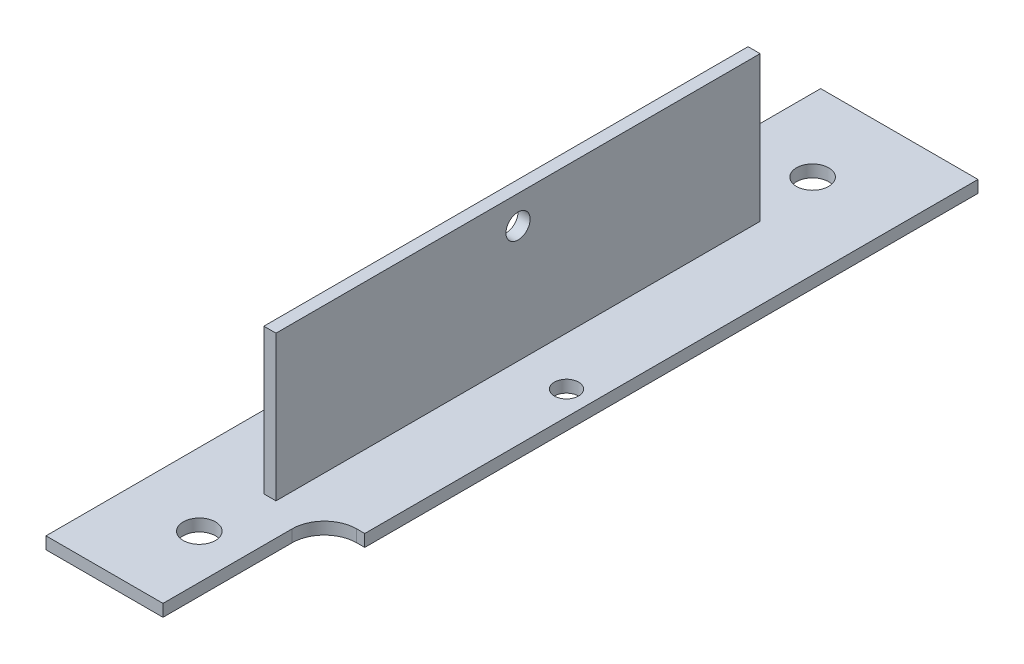
from build123d import *

# Parameters (mm, degrees)
ESQUISSE1_W             = 19.5
ESQUISSE1_H             = 1.5
EXTRU_MINCE1_DEPTH      = 96
ESQUISSE2_W             = 1.5
ESQUISSE2_H             = 19.5
EXTRU_MINCE2_DEPTH      = 96
ESQUISSE3_R             = 1.5
ESQUISSE3_W             = 18
ESQUISSE3_H             = 18
ENL_V_MAT_EXTRU_1_DEPTH = 3
ESQUISSE4_R             = 2
ESQUISSE4_R_2           = 1.5
ESQUISSE4_W             = 5
ESQUISSE4_H             = 20
ENL_V_MAT_EXTRU_2_DEPTH = 3
CONG_1_R                = 4


with BuildPart() as part:
    # Esquisse1 → Extru.-Mince1 (new body)
    with BuildSketch(Plane.XY):
        with Locations((0, 0.75)):
            Rectangle(ESQUISSE1_W, ESQUISSE1_H)
    extrude(amount=EXTRU_MINCE1_DEPTH)

    # Esquisse2 → Extru.-Mince2 (add)
    with BuildSketch(Plane(origin=(0, 0, 0), x_dir=(-1, 0, 0), z_dir=(0, 0, -1))):
        with Locations((0, 9.75)):
            Rectangle(ESQUISSE2_W, ESQUISSE2_H)
    extrude(amount=-EXTRU_MINCE2_DEPTH)

    # Esquisse3 → Enlèv. mat.-Extru.1 (cut)
    with BuildSketch(Plane.ZY.offset(0.75)):
        with Locations((48, 16)):
            Circle(ESQUISSE3_R)
        with Locations((9, 10.5)):
            Rectangle(ESQUISSE3_W, ESQUISSE3_H)
        with Locations((87, 10.5)):
            Rectangle(ESQUISSE3_W, ESQUISSE3_H)
    extrude(amount=-ENL_V_MAT_EXTRU_1_DEPTH, mode=Mode.SUBTRACT)

    # Esquisse4 → Enlèv. mat.-Extru.2 (cut)
    with BuildSketch(Plane(origin=(0, 1.5, 0), x_dir=(1, 0, 0), z_dir=(0, 1, 0))):
        with Locations(Location((-0.75, -10, 0), (0, 0, 270))):
            Circle(ESQUISSE4_R)
        with Locations(Location((-0.75, -86, 0), (0, 0, 270))):
            Circle(ESQUISSE4_R)
        with Locations(Location((6.75, -48, 0), (0, 0, 270))):
            Circle(ESQUISSE4_R_2)
        with Locations((7.25, -86)):
            Rectangle(ESQUISSE4_W, ESQUISSE4_H)
    extrude(amount=-ENL_V_MAT_EXTRU_2_DEPTH, mode=Mode.SUBTRACT)

    # Congé1
    cong_1_edges = [part.edges().sort_by_distance(p)[0] for p in [
        (4.75, 0.75, 76),
    ]]
    fillet(cong_1_edges, radius=CONG_1_R)


solid = part.part
